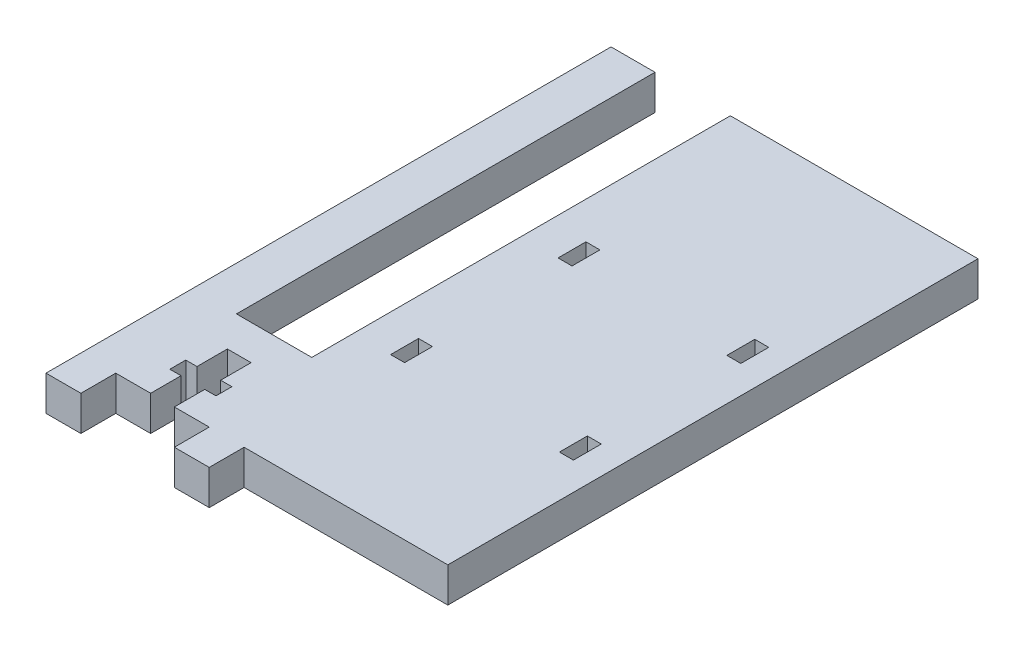
from build123d import *

# Parameters (mm, degrees)
SKETCH1_W           = 2.54
SKETCH1_H           = 5.08
BOSS_EXTRUDE1_DEPTH = 6.35


with BuildPart() as part:
    # Sketch1 → Boss-Extrude1 (new body)
    with BuildSketch(Plane(origin=(0, 0, 0), x_dir=(1, 0, 0), z_dir=(0, 1, 0))):
        Polygon((-6.858, 6.35), (-6.858, 82.55), (-14.859, 82.55), (-14.859, -13.97), (-14.859, -20.32), (-8.509, -20.32), (-8.509, -13.97), (-2.159, -13.97), (-2.159, -8.435000021), (-4.199999982, -8.435000021), (-4.199999982, -5.534999979), (-2.159, -5.534999979), (-2.159, 0), (2.159, 0), (2.159, -5.534999979), (4.199999982, -5.534999979), (4.199999982, -8.435000021), (2.159, -8.435000021), (2.159, -13.97), (8.509, -13.97), (8.509, -20.32), (14.859, -20.32), (14.859, -13.97), (45.593, -13.97), (51.943, -13.97), (51.943, 82.55), (45.593, 82.55), (14.859, 82.55), (6.858, 82.55), (6.858, 6.35), align=None)
        with Locations((14.859, 16.51)):
            Rectangle(SKETCH1_W, SKETCH1_H, mode=Mode.SUBTRACT)
        with Locations((45.593, 16.51)):
            Rectangle(SKETCH1_W, SKETCH1_H, mode=Mode.SUBTRACT)
        with Locations((14.859, 46.99)):
            Rectangle(SKETCH1_W, SKETCH1_H, mode=Mode.SUBTRACT)
        with Locations((45.593, 46.99)):
            Rectangle(SKETCH1_W, SKETCH1_H, mode=Mode.SUBTRACT)
    extrude(amount=BOSS_EXTRUDE1_DEPTH)


solid = part.part
